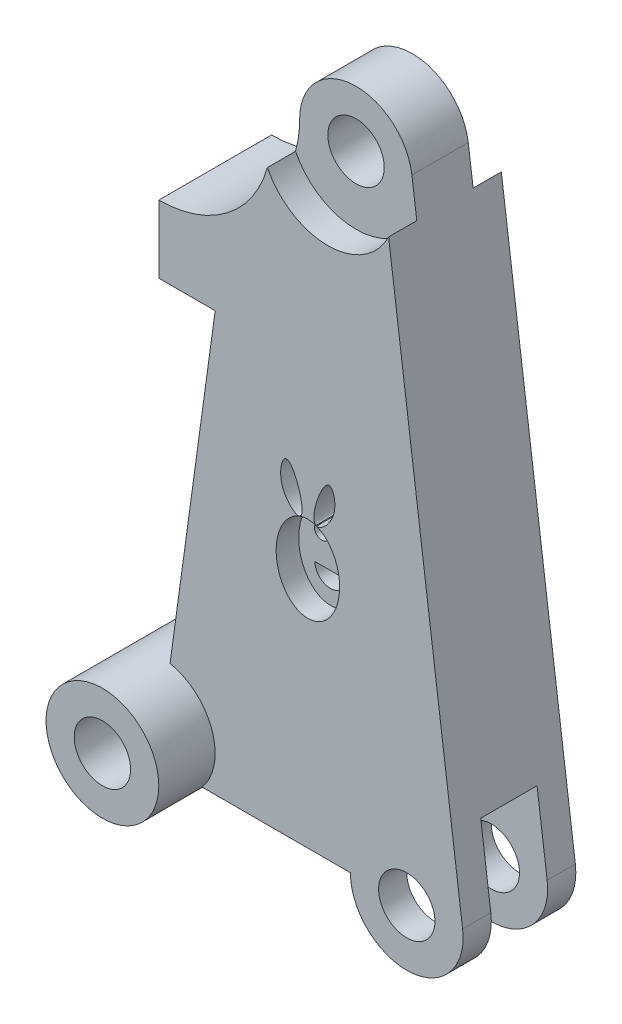
from build123d import *

# Parameters (mm, degrees)
SKETCH2_R               = 5
BOSS_EXTRUDE1_DEPTH     = 10
BOSS_EXTRUDE2_DEPTH     = 5
CUT_EXTRUDE1_DEPTH      = 64.079315152
CUT_EXTRUDE1_DEPTH_BACK = 64.079315152
SKETCH4_R               = 2.5
SKETCH5_R               = 6
CUT_EXTRUDE2_DEPTH      = 2.5
CUT_EXTRUDE3_DEPTH      = 2.5
CUT_EXTRUDE3_DEPTH_BACK = 2.5
SKETCH7_R               = 8.5
SKETCH9_RX              = 3.80806065
SKETCH9_RY              = 2.813161922
CUT_EXTRUDE4_DEPTH      = 2
CUT_EXTRUDE5_DEPTH      = 2
SKETCH12_R              = 0.65
CUT_EXTRUDE6_DEPTH      = 63.633856702
CUT_EXTRUDE7_DEPTH      = 63.633856702


with BuildPart() as part:
    # Sketch2 → Boss-Extrude1 (new, symmetric)
    with BuildSketch(Plane.XY):
        Circle(SKETCH2_R)
    extrude(amount=BOSS_EXTRUDE1_DEPTH, both=True)

    # Sketch3 → Boss-Extrude2 (add, symmetric)
    with BuildSketch(Plane.XY):
        with BuildLine():
            Line((1, 4.898979486), (5, 34))
            Line((5, 34), (0, 34))
            Line((0, 34), (0, 40))
            ThreePointArc((0, 40), (7.071067812, 42.928932188), (10, 50))
            ThreePointArc((10, 50), (14.673051661, 54.989299027), (19.957241913, 50.652497212))
            Line((19.957241913, 50.652497212), (26.957241913, -2.528869287))
            ThreePointArc((26.957241913, -2.528869287), (22.326948339, -8.170665526), (17, -3.181366499))
            Line((17, -3.181366499), (3.857318654, -3.181366499))
            Line((3.857318654, -3.181366499), (1, 4.898979486))
        make_face()
    extrude(amount=BOSS_EXTRUDE2_DEPTH, both=True)

    # Sketch4 → Cut-Extrude1 (cut, two sides: drawn at the far end of the back side and taken through both)
    with BuildSketch(Plane.XY.offset(5).offset(-CUT_EXTRUDE1_DEPTH_BACK)):
        with Locations((15, 50)):
            Circle(SKETCH4_R)
        Circle(SKETCH4_R)
        with Locations((22, -3.181366499)):
            Circle(SKETCH4_R)
    extrude(amount=CUT_EXTRUDE1_DEPTH + CUT_EXTRUDE1_DEPTH_BACK, mode=Mode.SUBTRACT)

    # Sketch5 → Cut-Extrude2 (cut)
    with BuildSketch(Plane.XY.offset(5)):
        with Locations((15, 50)):
            Circle(SKETCH5_R)
    cut_extrude2 = extrude(amount=-CUT_EXTRUDE2_DEPTH, mode=Mode.SUBTRACT)

    # Mirror1: Cut-Extrude2 across plane
    add(cut_extrude2.mirror(Plane.XY), mode=Mode.SUBTRACT)

    # Sketch7 → Cut-Extrude3 (cut, two sides: drawn at the far end of the back side and taken through both)
    with BuildSketch(Plane.XY.offset(-CUT_EXTRUDE3_DEPTH_BACK)):
        with Locations((22, -3.181366499)):
            Circle(SKETCH7_R)
    extrude(amount=CUT_EXTRUDE3_DEPTH + CUT_EXTRUDE3_DEPTH_BACK, mode=Mode.SUBTRACT)

    # Sketch9 → Cut-Extrude4 (cut)
    with BuildSketch(Plane.XY.offset(5)):
        with Locations(Location((13.227873683, 18.281882493), (0, 0, 90))):
            Ellipse(SKETCH9_RX, SKETCH9_RY)
    cut_extrude4 = extrude(amount=-CUT_EXTRUDE4_DEPTH, mode=Mode.SUBTRACT)

    # Sketch11 → Cut-Extrude5 (cut)
    with BuildSketch(Plane.XY.offset(5)):
        with BuildLine():
            add(Edge.make_bspline(
                [(12.522028797, 21.968126834), (12.172187814, 21.786407618), (10.359411342, 23.317925648), (11.369156283, 27.907682858), (13.176267664, 22.307960587), (12.522028797, 21.968126834)],
                knots=[0, 0, 0, 0, 0.25167876, 0.529334656, 1, 1, 1, 1], degree=3))
        make_face()
        with BuildLine():
            add(Edge.make_bspline(
                [(13.933718568, 21.968126834), (14.276902775, 21.772094059), (16.056700712, 23.2943812), (15.069290945, 27.627740223), (13.320756239, 22.318261556), (13.933718568, 21.968126834)],
                knots=[0, 0, 0, 0, 0.263421901, 0.529501361, 1, 1, 1, 1], degree=3))
        make_face()
    cut_extrude5 = extrude(amount=-CUT_EXTRUDE5_DEPTH, mode=Mode.SUBTRACT)

    # Sketch12 → Cut-Extrude6 (cut, through all)
    with BuildSketch(Plane.XY.offset(3)):
        with Locations((12.466071171, 19.745676536)):
            Circle(SKETCH12_R)
        with Locations((13.933718568, 19.745676536)):
            Circle(SKETCH12_R)
    extrude(amount=-CUT_EXTRUDE6_DEPTH, mode=Mode.SUBTRACT)

    # Sketch13 → Cut-Extrude7 (cut, through all)
    with BuildSketch(Plane.XY.offset(3)):
        with BuildLine():
            Line((11.848135132, 17.156912107), (14.607612233, 17.156912107))
            ThreePointArc((14.607612233, 17.156912107), (13.227873683, 15.777173557), (11.848135132, 17.156912107))
        make_face()
    extrude(amount=-CUT_EXTRUDE7_DEPTH, mode=Mode.SUBTRACT)

    # Mirror2: Cut-Extrude4, Cut-Extrude5 across plane
    add(cut_extrude4.mirror(Plane.XY), mode=Mode.SUBTRACT)
    add(cut_extrude5.mirror(Plane.XY), mode=Mode.SUBTRACT)


solid = part.part
